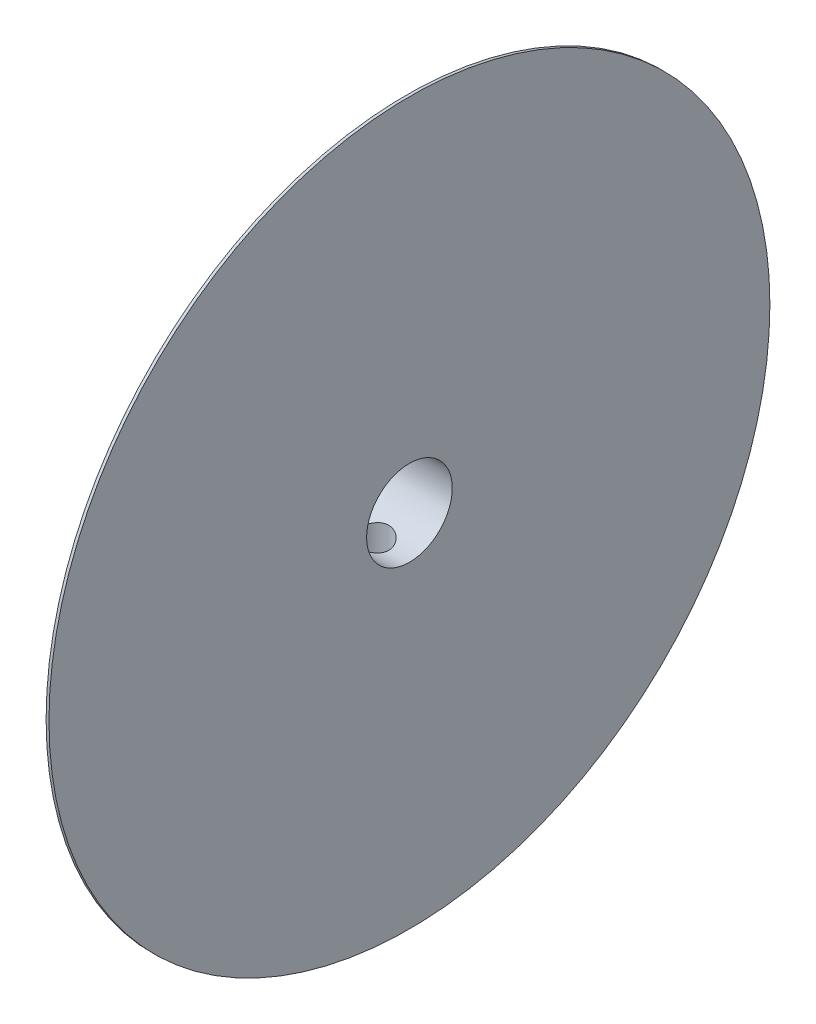
from build123d import *

# Parameters (mm, degrees)
SKETCH_1_R                      = 25.25
EXTRUDE_1_DEPTH                 = 0.2
SKETCH_2_R                      = 7.25
EXTRUDE_2_DEPTH                 = 5
CUT_EXTRUDE_1_REACH             = 38.086
SKETCH_3_R                      = 3
CUT_EXTRUDE_2_REACH             = 38.057
SKETCH_4_R                      = 1.25
CUT_EXTRUDE_2_DIRECTION_2_REACH = 38.057


with BuildPart() as part:
    # 草图1 → 凸台-拉伸1 (new body)
    with BuildSketch(Plane(origin=(0, 0, 0), x_dir=(0, 0, -1), z_dir=(1, 0, 0))):
        Circle(SKETCH_1_R)
    extrude(amount=EXTRUDE_1_DEPTH)

    # 草图2 → 凸台-拉伸2 (add)
    with BuildSketch(Plane.ZY):
        Circle(SKETCH_2_R)
    extrude(amount=EXTRUDE_2_DEPTH)

    # 草图3 → 切除-拉伸1 (cut, up to next)
    with BuildSketch(Plane.ZY.offset(5), mode=Mode.PRIVATE) as cut_extrude_1_sk1:
        Circle(SKETCH_3_R)
    cut_extrude_1_tool1 = extrude(cut_extrude_1_sk1.sketch, amount=-CUT_EXTRUDE_1_REACH, mode=Mode.PRIVATE) & part.part
    add(cut_extrude_1_tool1.solids().sort_by_distance((-5, 0, 0))[0], mode=Mode.SUBTRACT)

    # 草图4 → 切除-拉伸2 (cut, up to next)
    with BuildSketch(Plane(origin=(0, 0, 0), x_dir=(1, 0, 0), z_dir=(0, 1, 0)), mode=Mode.PRIVATE) as cut_extrude_2_sk1:
        with Locations(Location((-2.5, 0, 0), (0, 0, 270))):
            Circle(SKETCH_4_R)
    cut_extrude_2_tool1 = extrude(cut_extrude_2_sk1.sketch, amount=-CUT_EXTRUDE_2_REACH, mode=Mode.PRIVATE) & part.part
    add(cut_extrude_2_tool1.solids().sort_by_distance((-2.5, 0, 0))[0], mode=Mode.SUBTRACT)

    # 草图4 → 切除-拉伸2 direction 2 (cut, up to next)
    with BuildSketch(Plane(origin=(0, 0, 0), x_dir=(1, 0, 0), z_dir=(0, 1, 0)), mode=Mode.PRIVATE) as cut_extrude_2_direction_2_sk1:
        with Locations(Location((-2.5, 0, 0), (0, 0, 270))):
            Circle(SKETCH_4_R)
    cut_extrude_2_direction_2_tool1 = extrude(cut_extrude_2_direction_2_sk1.sketch, amount=CUT_EXTRUDE_2_DIRECTION_2_REACH, mode=Mode.PRIVATE) & part.part
    add(cut_extrude_2_direction_2_tool1.solids().sort_by_distance((-2.5, 0, 0))[0], mode=Mode.SUBTRACT)


solid = part.part
